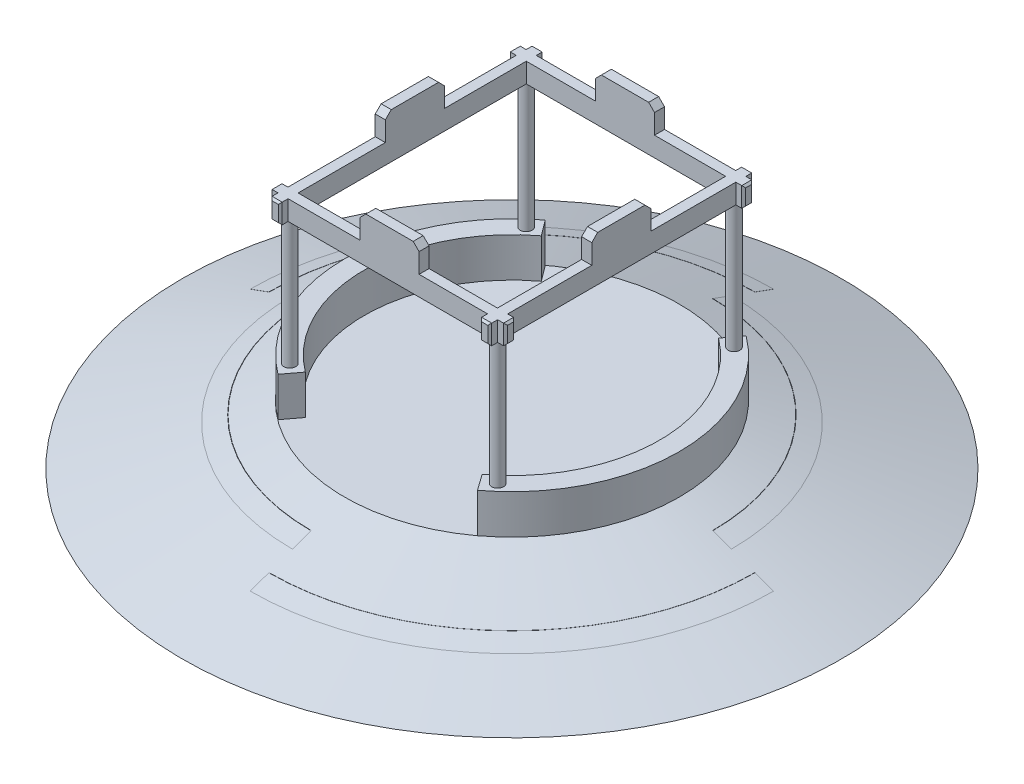
from build123d import *

# Parameters (mm, degrees)
SKETCH_2_W        = 850
SKETCH_2_H        = 300
EXTRUDE_1_DEPTH   = 200
SKETCH_9_R        = 30
EXTRUDE_2_DEPTH   = 650
EXTRUDE_2_2_DEPTH = 650
EXTRUDE_2_3_DEPTH = 650
EXTRUDE_2_4_DEPTH = 650
SKETCH_10_W       = 40
SKETCH_10_H       = 50.651377378
SKETCH_10_W_2     = 51.417815055
SKETCH_10_H_2     = 40
SKETCH_10_W_3     = 1012.831920557
SKETCH_10_W_4     = 51.594176572
SKETCH_10_H_3     = 50.82526202
EXTRUDE_3_DEPTH   = 100
SKETCH_11_W       = 51.735384241
SKETCH_11_H       = 1159.312229664
EXTRUDE_4_DEPTH   = 100
CHAMFER_1_SIZE    = 10
CHAMFER_2_SIZE    = 10
CHAMFER_3_SIZE    = 10
SKETCH_14_W       = 300.420598197
SKETCH_14_H       = 50.651377378
SKETCH_14_W_2     = 51.735384241
SKETCH_14_H_2     = 300
SKETCH_14_W_3     = 300
SKETCH_14_H_3     = 50.82526202
SKETCH_14_W_4     = 51.417815055
EXTRUDE_5_DEPTH   = 130
CHAMFER_6_SIZE    = 30
CHAMFER_7_SIZE    = 30
REVOLVE_3_ANGLE   = 90
REVOLVE_4_ANGLE   = 90
REVOLVE_5_ANGLE   = 90
REVOLVE_6_ANGLE   = 90


with BuildPart() as part:
    # 草图2 → 旋转1 (revolve)
    with BuildSketch(Plane.XY, mode=Mode.PRIVATE) as revolve_1_sk:
        with Locations((425, -150)):
            Rectangle(SKETCH_2_W, SKETCH_2_H)
        Polygon((1674.243225836, -300), (850, 0), (850, -300), align=None)
    revolve(revolve_1_sk.sketch.rotate(Axis((0, 0, 0), (0, -1, 0)), 180), axis=Axis((0, 0, 0), (0, -1, 0)))

    # 草图7 → 凸台-拉伸1 (add)
    with BuildSketch(Plane(origin=(0, 0, 0), x_dir=(1, 0, 0), z_dir=(0, 1, 0))):
        with BuildLine():
            Line((-450.209657385, -599.355150386), (-510, -678.444772222))
            ThreePointArc((-510, -678.444772222), (-848.756305289, 0.207818597), (-509.66770348, 678.694438599))
            Line((-509.66770348, 678.694438599), (-450, 599.512578598))
            ThreePointArc((-450, 599.512578598), (-749.610108464, 0.131091439), (-450.209657385, -599.355150386))
        make_face()
        with BuildLine():
            Line((510.057293827, 679.957025858), (450, 599.512578598))
            ThreePointArc((450, 599.512578598), (749.609824622, -0.665376802), (448.935000026, -600.310501031))
            Line((448.935000026, -600.310501031), (507.169627968, -682.113603784))
            ThreePointArc((507.169627968, -682.113603784), (849.998089786, -1.802043456), (510.057293827, 679.957025858))
        make_face()
    extrude(amount=EXTRUDE_1_DEPTH)

    # 草图16 → 旋转3 (revolve)
    with BuildSketch(Plane.XY):
        Polygon((0, -174), (1329, -174), (1235.030737921, -139.797985667), (0, -139.797985667), align=None)
    revolve(axis=Axis((0, 0, 0), (0, -1, 0)), revolution_arc=REVOLVE_3_ANGLE)

    # 草图19 → 旋转4 (revolve)
    with BuildSketch(Plane.XY):
        Polygon((0, -174), (-1329, -174), (-1235.030737921, -139.797985667), (0, -139.797985667), align=None)
    revolve(axis=Axis((0, 0, 0), (0, -1, 0)), revolution_arc=REVOLVE_4_ANGLE)

    # 草图20 → 旋转5 (revolve)
    with BuildSketch(Plane.XY):
        Polygon((0, -96), (1115, -96), (1021.030737921, -61.797985667), (0, -61.797985667), align=None)
    revolve(axis=Axis((0, 0, 0), (0, 1, 0)), revolution_arc=REVOLVE_5_ANGLE)

    # 草图21 → 旋转6 (revolve)
    with BuildSketch(Plane.XY):
        Polygon((0, -96), (-1115, -96), (-1021.030737921, -61.797985667), (0, -61.797985667), align=None)
    revolve(axis=Axis((0, 0, 0), (0, 1, 0)), revolution_arc=REVOLVE_6_ANGLE)


with BuildPart() as body_2:
    # 草图9 → 凸台-拉伸2 (new body)
    with BuildSketch(Plane(origin=(0, 200, 0), x_dir=(1, 0, 0), z_dir=(0, 1, 0))):
        with Locations(Location((-527.921956092, -600.394434531, 0), (0, 0, 270))):
            Circle(SKETCH_9_R)
    extrude(amount=EXTRUDE_2_DEPTH)



with BuildPart() as body_3:
    # 草图9 → Extrude 2 2 (new body)
    with BuildSketch(Plane(origin=(0, 200, 0), x_dir=(1, 0, 0), z_dir=(0, 1, 0))):
        with Locations(Location((527.921956092, -600.394434531, 0), (0, 0, 270))):
            Circle(SKETCH_9_R)
    extrude(amount=EXTRUDE_2_2_DEPTH)


with BuildPart() as body_4:
    # 草图9 → Extrude 2 3 (new body)
    with BuildSketch(Plane(origin=(0, 200, 0), x_dir=(1, 0, 0), z_dir=(0, 1, 0))):
        with Locations(Location((527.921956092, 600.394434531, 0), (0, 0, 270))):
            Circle(SKETCH_9_R)
    extrude(amount=EXTRUDE_2_3_DEPTH)


with BuildPart() as body_5:
    # 草图9 → Extrude 2 4 (new body)
    with BuildSketch(Plane(origin=(0, 200, 0), x_dir=(1, 0, 0), z_dir=(0, 1, 0))):
        with Locations(Location((-527.921956092, 600.394434531, 0), (0, 0, 270))):
            Circle(SKETCH_9_R)
    extrude(amount=EXTRUDE_2_4_DEPTH)


with BuildPart() as body_2_1:
    add(body_2.part)

    add(body_3.part)  # 凸台-拉伸3 merges body 3

    add(body_4.part)  # 凸台-拉伸3 merges body 4

    add(body_5.part)  # 凸台-拉伸3 merges body 5
    # 草图10 → 凸台-拉伸3 (add)
    with BuildSketch(Plane(origin=(0, 850, 0), x_dir=(1, 0, 0), z_dir=(0, 1, 0))):
        Polygon((-597.921956092, 579.569172511), (-557.921956092, 579.569172511), (-557.921956092, 600.394434531), (-557.921956092, 630.394434531), (-597.921956092, 630.394434531), align=None)
        with BuildLine():
            Line((-557.921956092, 630.394434531), (-557.921956092, 600.394434531))
            ThreePointArc((-557.921956092, 600.394434531), (-549.135159528, 621.607637966), (-527.921956092, 630.394434531))
            Line((-527.921956092, 630.394434531), (-557.921956092, 630.394434531))
        make_face()
        with BuildLine():
            Line((-557.921956092, 600.394434531), (-557.921956092, 579.569172511))
            Line((-557.921956092, 579.569172511), (-549.516132664, 579.569172511))
            ThreePointArc((-549.516132664, 579.569172511), (-555.741241643, 589.165572103), (-557.921956092, 600.394434531))
        make_face()
        with BuildLine():
            Line((-549.516132664, 579.569172511), (-506.504141037, 579.569172511))
            Line((-506.504141037, 579.569172511), (-506.504141037, 621.401033452))
            ThreePointArc((-506.504141037, 621.401033452), (-516.30726642, 628.054857229), (-527.921956092, 630.394434531))
            ThreePointArc((-527.921956092, 630.394434531), (-549.135159528, 621.607637966), (-557.921956092, 600.394434531))
            ThreePointArc((-557.921956092, 600.394434531), (-555.741241643, 589.165572103), (-549.516132664, 579.569172511))
        make_face()
        with BuildLine():
            ThreePointArc((-527.921956092, 630.394434531), (-516.30726642, 628.054857229), (-506.504141037, 621.401033452))
            Line((-506.504141037, 621.401033452), (-506.504141037, 630.394434531))
            Line((-506.504141037, 630.394434531), (-527.921956092, 630.394434531))
        make_face()
        Polygon((-557.921956092, 670.394434531), (-557.921956092, 630.394434531), (-527.921956092, 630.394434531), (-506.504141037, 630.394434531), (-506.504141037, 670.394434531), align=None)
        with BuildLine():
            Line((-506.504141037, 621.401033452), (-506.504141037, 579.569172511))
            Line((-506.504141037, 579.569172511), (-506.32777952, 579.569172511))
            ThreePointArc((-506.32777952, 579.569172511), (-500.102670541, 589.165572103), (-497.921956092, 600.394434531))
            ThreePointArc((-497.921956092, 600.394434531), (-500.150257804, 611.740481162), (-506.504141037, 621.401033452))
        make_face()
        with BuildLine():
            ThreePointArc((-549.516132664, 579.569172511), (-528.048433814, 570.394701142), (-506.504141037, 579.387835609))
            Line((-506.504141037, 579.387835609), (-506.504141037, 579.569172511))
            Line((-506.504141037, 579.569172511), (-549.516132664, 579.569172511))
        make_face()
        with BuildLine():
            Line((-557.921956092, -579.743057153), (-506.504141037, -579.743057153))
            Line((-506.504141037, -579.743057153), (-506.504141037, 579.387835609))
            ThreePointArc((-506.504141037, 579.387835609), (-528.048433814, 570.394701142), (-549.516132664, 579.569172511))
            Line((-549.516132664, 579.569172511), (-557.921956092, 579.569172511))
            Line((-557.921956092, 579.569172511), (-557.921956092, -579.743057153))
        make_face()
        with BuildLine():
            Line((-506.32777952, 579.569172511), (506.32777952, 579.569172511))
            Line((506.32777952, 579.569172511), (506.32777952, 630.394434531))
            Line((506.32777952, 630.394434531), (-506.504141037, 630.394434531))
            Line((-506.504141037, 630.394434531), (-506.504141037, 621.401033452))
            ThreePointArc((-506.504141037, 621.401033452), (-500.150257804, 611.740481162), (-497.921956092, 600.394434531))
            ThreePointArc((-497.921956092, 600.394434531), (-500.102670541, 589.165572103), (-506.32777952, 579.569172511))
        make_face()
        with Locations((-577.921956092, -605.068745842)):
            Rectangle(SKETCH_10_W, SKETCH_10_H)
        with Locations((-532.213048565, -605.068745842)):
            Rectangle(SKETCH_10_W_2, SKETCH_10_H)
        with Locations((-532.213048565, -650.394434531)):
            Rectangle(SKETCH_10_W_2, SKETCH_10_H_2)
        with Locations((-0.088180758, -605.068745842)):
            Rectangle(SKETCH_10_W_3, SKETCH_10_H)
        with Locations((532.124867806, -605.068745842)):
            Rectangle(SKETCH_10_W_4, SKETCH_10_H)
        Polygon((557.921956092, -630.394434531), (506.32777952, -630.394434531), (506.32777952, -633.088964608), (506.32777952, -670.394434531), (557.921956092, -670.394434531), align=None)
        with Locations((577.921956092, -605.068745842)):
            Rectangle(SKETCH_10_W, SKETCH_10_H)
        with Locations((532.124867806, 650.394434531)):
            Rectangle(SKETCH_10_W_4, SKETCH_10_H_2)
        with Locations((532.124867806, 604.981803521)):
            Rectangle(SKETCH_10_W_4, SKETCH_10_H_3)
        with Locations((577.921956092, 604.981803521)):
            Rectangle(SKETCH_10_W, SKETCH_10_H_3)
    extrude(amount=EXTRUDE_3_DEPTH)

    # 草图11 → 凸台-拉伸4 (add)
    with BuildSketch(Plane(origin=(0, 850, 0), x_dir=(1, 0, 0), z_dir=(0, 1, 0))):
        with Locations((532.029119441, -0.086942321)):
            Rectangle(SKETCH_11_W, SKETCH_11_H)
    extrude(amount=EXTRUDE_4_DEPTH)

    # 倒角1
    chamfer_1_edges = [body_2_1.edges().sort_by_distance(p)[0] for p in [
        (597.921956092, 950, 605.068745842),
        (597.921956092, 900, 630.394434531),
        (597.921956092, 900, 579.743057153),
        (597.921956092, 850, 605.068745842),
    ]]
    chamfer(chamfer_1_edges, length=CHAMFER_1_SIZE)

    # 倒角2
    chamfer_2_edges = [body_2_1.edges().sort_by_distance(p)[0] for p in [
        (532.124867806, 950, 670.394434531),
        (506.32777952, 900, 670.394434531),
        (557.921956092, 900, 670.394434531),
        (532.124867806, 850, 670.394434531),
    ]]
    chamfer(chamfer_2_edges, length=CHAMFER_2_SIZE)

    # 倒角3
    chamfer_3_edges = [body_2_1.edges().sort_by_distance(p)[0] for p in [
        (532.124867806, 850, -670.394434531),
        (597.921956092, 850, -604.981803521),
        (597.921956092, 950, -604.981803521),
        (597.921956092, 900, -579.569172511),
        (597.921956092, 900, -630.394434531),
        (532.124867806, 950, -670.394434531),
        (557.921956092, 900, -670.394434531),
        (506.32777952, 900, -670.394434531),
        (-532.213048564, 850, -670.394434531),
        (-506.504141037, 900, -670.394434531),
        (-557.921956092, 900, -670.394434531),
        (-597.921956092, 850, -604.981803521),
        (-597.921956092, 900, -630.394434531),
        (-597.921956092, 900, -579.569172511),
        (-597.921956092, 850, 605.068745842),
        (-597.921956092, 900, 579.743057153),
        (-597.921956092, 900, 630.394434531),
        (-532.213048564, 850, 670.394434531),
        (-557.921956092, 900, 670.394434531),
        (-506.504141037, 900, 670.394434531),
        (-532.213048564, 950, -670.394434531),
        (-597.921956092, 950, -604.981803521),
        (-597.921956092, 950, 605.068745842),
        (-532.213048564, 950, 670.394434531),
    ]]
    chamfer(chamfer_3_edges, length=CHAMFER_3_SIZE)

    # 草图14 → 凸台-拉伸5 (add)
    with BuildSketch(Plane(origin=(0, 950, 0), x_dir=(1, 0, 0), z_dir=(0, 1, 0))):
        with Locations((8.630208478, -605.068745842)):
            Rectangle(SKETCH_14_W, SKETCH_14_H)
        with Locations((532.029119441, -2.109217431)):
            Rectangle(SKETCH_14_W_2, SKETCH_14_H_2)
        with Locations((-5.057905502, 604.981803521)):
            Rectangle(SKETCH_14_W_3, SKETCH_14_H_3)
        with Locations((-532.213048565, 13.672950277)):
            Rectangle(SKETCH_14_W_4, SKETCH_14_H_2)
    extrude(amount=EXTRUDE_5_DEPTH)

    # 倒角6
    chamfer_6_edges = [body_2_1.edges().sort_by_distance(p)[0] for p in [
        (532.029119441, 1080, 152.109217431),
    ]]
    chamfer(chamfer_6_edges, length=CHAMFER_6_SIZE)

    # 倒角7
    chamfer_7_edges = [body_2_1.edges().sort_by_distance(p)[0] for p in [
        (-141.580090621, 1080, 605.068745842),
        (158.840507576, 1080, 605.068745842),
        (532.029119441, 1080, -147.890782569),
        (-155.057905502, 1080, -604.981803521),
        (144.942094498, 1080, -604.981803521),
        (-532.213048564, 1080, 136.327049723),
        (-532.213048564, 1080, -163.672950277),
    ]]
    chamfer(chamfer_7_edges, length=CHAMFER_7_SIZE)


solid = Compound([part.part, body_2_1.part])
